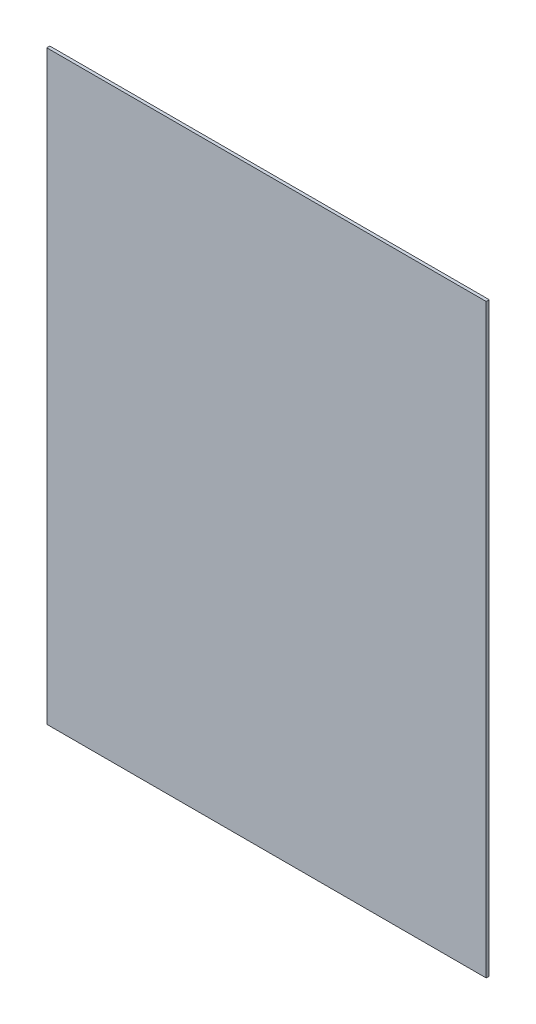
from build123d import *

# Parameters (mm, degrees)
SKETCH1_W           = 914.4
SKETCH1_H           = 1219.2
BOSS_EXTRUDE1_DEPTH = 6.35


with BuildPart() as part:
    # Sketch1 → Boss-Extrude1 (new body)
    with BuildSketch(Plane.XY):
        Rectangle(SKETCH1_W, SKETCH1_H)
    extrude(amount=BOSS_EXTRUDE1_DEPTH)


solid = part.part
